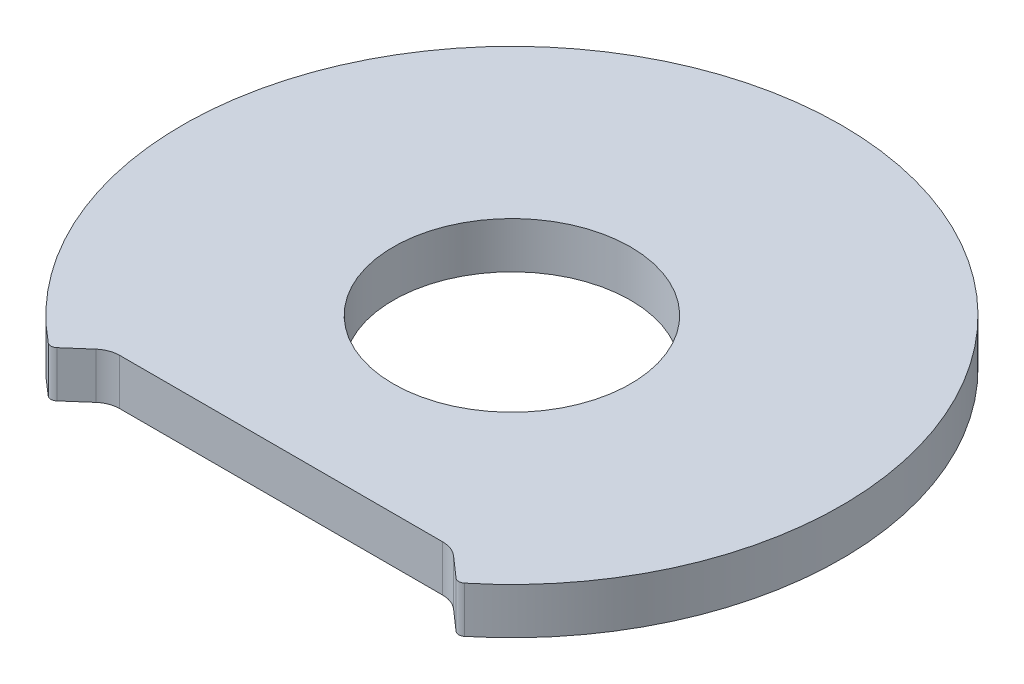
from build123d import *

# Parameters (mm, degrees)
SKETCH1_R           = 18
BOSS_EXTRUDE1_DEPTH = 7


with BuildPart() as part:
    # Sketch1 → Boss-Extrude1 (new body)
    with BuildSketch(Plane(origin=(0, 0, 0), x_dir=(1, 0, 0), z_dir=(0, 1, 0))):
        with BuildLine():
            Line((24.5, -35), (-24.5, -35))
            ThreePointArc((-24.5, -35), (-25.911238902, -35.257219648), (-27.140978616, -35.995797619))
            Line((-27.140978616, -35.995797619), (-30.275171942, -38.751050595))
            ThreePointArc((-30.275171942, -38.751050595), (-30.916482245, -38.999820729), (-31.566751629, -38.775510204))
            ThreePointArc((-31.566751629, -38.775510204), (0, 50), (31.566751629, -38.775510204))
            ThreePointArc((31.566751629, -38.775510204), (30.916482245, -38.999820729), (30.275171942, -38.751050595))
            Line((30.275171942, -38.751050595), (27.140978616, -35.995797619))
            ThreePointArc((27.140978616, -35.995797619), (25.911238902, -35.257219648), (24.5, -35))
        make_face()
        with Locations(Location((0, 0, 0), (0, 0, 270))):
            Circle(SKETCH1_R, mode=Mode.SUBTRACT)
    extrude(amount=BOSS_EXTRUDE1_DEPTH)


solid = part.part
